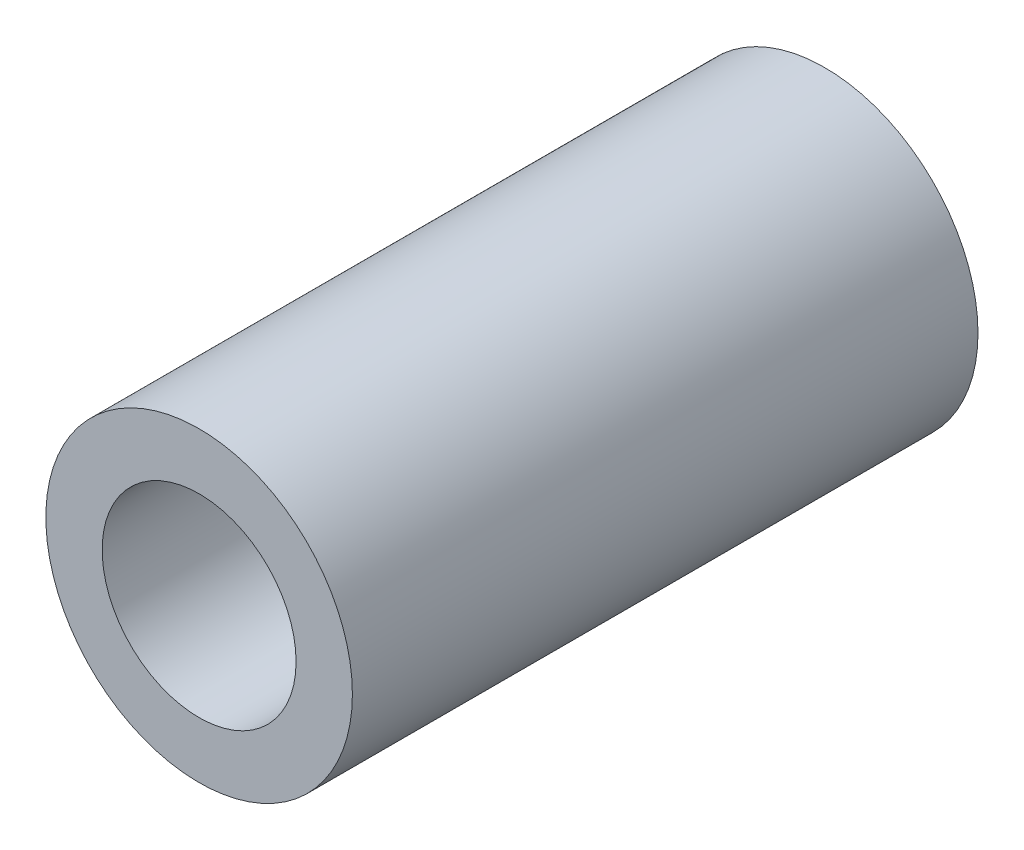
from build123d import *

# Parameters (mm, degrees)
SKETCH_1_R      = 4.9
SKETCH_1_R_2    = 3.1
EXTRUDE_1_DEPTH = 20


with BuildPart() as part:
    # ｽｹｯﾁ1 → ﾎﾞｽ - 押し出し1 (new body)
    with BuildSketch(Plane.XY):
        Circle(SKETCH_1_R)
        Circle(SKETCH_1_R_2, mode=Mode.SUBTRACT)
    extrude(amount=EXTRUDE_1_DEPTH)


solid = part.part
